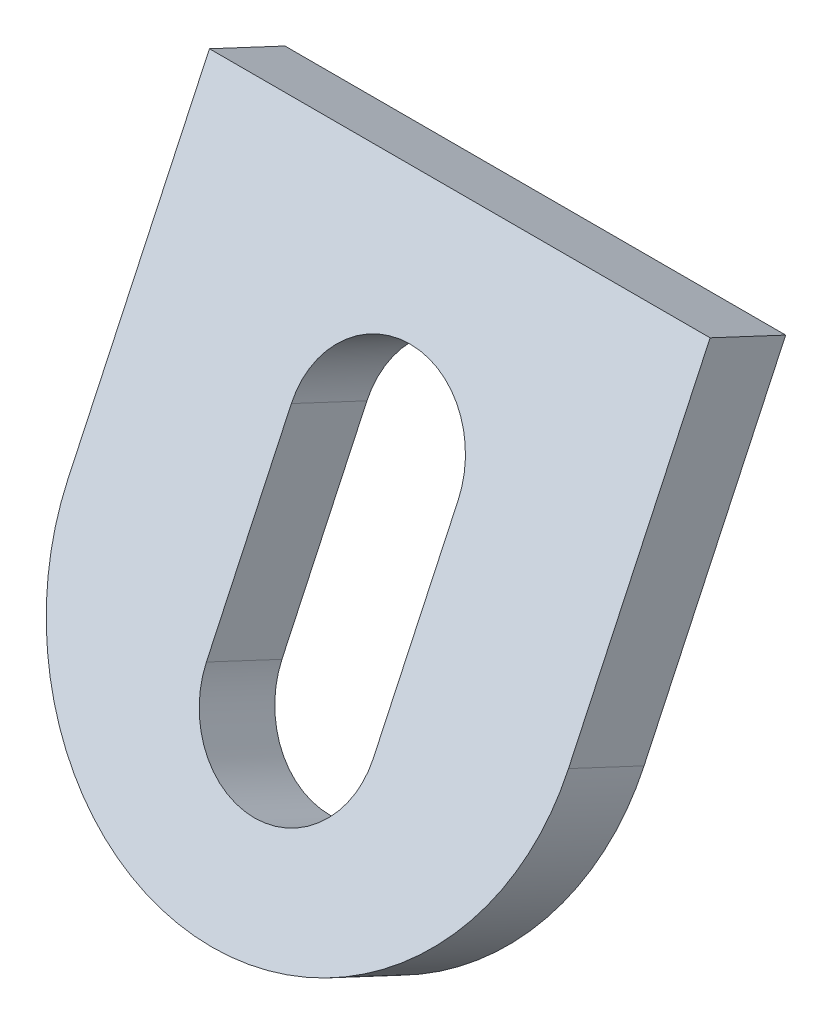
from build123d import *

# Parameters (mm, degrees)
BOSS_EXTRUDE1_DEPTH = 3.175


with BuildPart() as part:
    # Sketch1 → Boss-Extrude1 (new body)
    with BuildSketch(Plane(origin=(0, 24.05298106, 51.338092747), x_dir=(1, 0, 0), z_dir=(0, 0.42426395071815903, 0.9055385690963249))):
        with BuildLine():
            Line((-223.489586571, 437.581228051), (-204.439586571, 437.581228051))
            Line((-204.439586571, 437.581228051), (-204.439586571, 424.881228051))
            ThreePointArc((-204.439586571, 424.881228051), (-213.964586571, 415.356228051), (-223.489586571, 424.881228051))
            Line((-223.489586571, 424.881228051), (-223.489586571, 437.581228051))
        make_face()
        with BuildLine():
            Line((-210.789586571, 422.341228051), (-210.789586571, 429.961228051))
            ThreePointArc((-210.789586571, 429.961228051), (-213.964586571, 433.136228051), (-217.139586571, 429.961228051))
            Line((-217.139586571, 429.961228051), (-217.139586571, 422.341228051))
            ThreePointArc((-217.139586571, 422.341228051), (-213.964586571, 419.166228051), (-210.789586571, 422.341228051))
        make_face(mode=Mode.SUBTRACT)
    extrude(amount=BOSS_EXTRUDE1_DEPTH)


solid = part.part
